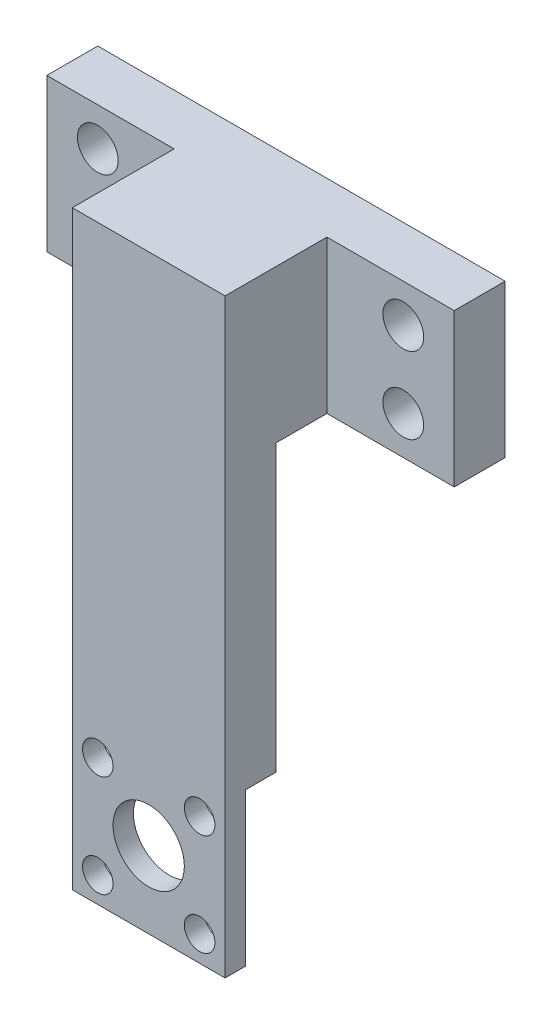
from build123d import *

# Parameters (mm, degrees)
SKETCH2_W           = 40
SKETCH2_H           = 15
SKETCH2_R           = 2
BOSS_EXTRUDE1_DEPTH = 5
SKETCH3_W           = 15
SKETCH3_H           = 15
BOSS_EXTRUDE2_DEPTH = 10
SKETCH4_W           = 15
SKETCH4_H           = 5
BOSS_EXTRUDE3_DEPTH = 28
SKETCH5_W           = 15
SKETCH5_H           = 2
BOSS_EXTRUDE4_DEPTH = 15
SKETCH6_R           = 1.5
SKETCH6_R_2         = 3.5
CUT_EXTRUDE1_DEPTH  = 15


with BuildPart() as part:
    # Sketch2 → Boss-Extrude1 (new body)
    with BuildSketch(Plane.XY):
        with Locations((20, 7.5)):
            Rectangle(SKETCH2_W, SKETCH2_H)
        with Locations((5, 3.75)):
            Circle(SKETCH2_R, mode=Mode.SUBTRACT)
        with Locations(Location((5, 11.25, 0), (0, 0, 180))):
            Circle(SKETCH2_R, mode=Mode.SUBTRACT)
        with Locations(Location((35, 3.75, 0), (0, 0, 180))):
            Circle(SKETCH2_R, mode=Mode.SUBTRACT)
        with Locations((35, 11.25)):
            Circle(SKETCH2_R, mode=Mode.SUBTRACT)
    extrude(amount=BOSS_EXTRUDE1_DEPTH)

    # Sketch3 → Boss-Extrude2 (add)
    with BuildSketch(Plane.XY.offset(5)):
        with Locations((20, 7.5)):
            Rectangle(SKETCH3_W, SKETCH3_H)
    extrude(amount=BOSS_EXTRUDE2_DEPTH)

    # Sketch4 → Boss-Extrude3 (add)
    with BuildSketch(Plane.XZ):
        with Locations((20, 12.5)):
            Rectangle(SKETCH4_W, SKETCH4_H)
    extrude(amount=BOSS_EXTRUDE3_DEPTH)

    # Sketch5 → Boss-Extrude4 (add)
    with BuildSketch(Plane.XZ.offset(28)):
        with Locations((20, 14)):
            Rectangle(SKETCH5_W, SKETCH5_H)
    extrude(amount=BOSS_EXTRUDE4_DEPTH)

    # Sketch6 → Cut-Extrude1 (cut)
    with BuildSketch(Plane(origin=(0, 0, 13), x_dir=(-1, 0, 0), z_dir=(0, 0, -1))):
        with Locations((-15, -30.5)):
            Circle(SKETCH6_R)
        with Locations((-25, -30.5)):
            Circle(SKETCH6_R)
        with Locations((-20, -35.5)):
            Circle(SKETCH6_R_2)
        with Locations((-15, -40.5)):
            Circle(SKETCH6_R)
        with Locations((-25, -40.5)):
            Circle(SKETCH6_R)
    extrude(amount=-CUT_EXTRUDE1_DEPTH, mode=Mode.SUBTRACT)


solid = part.part
